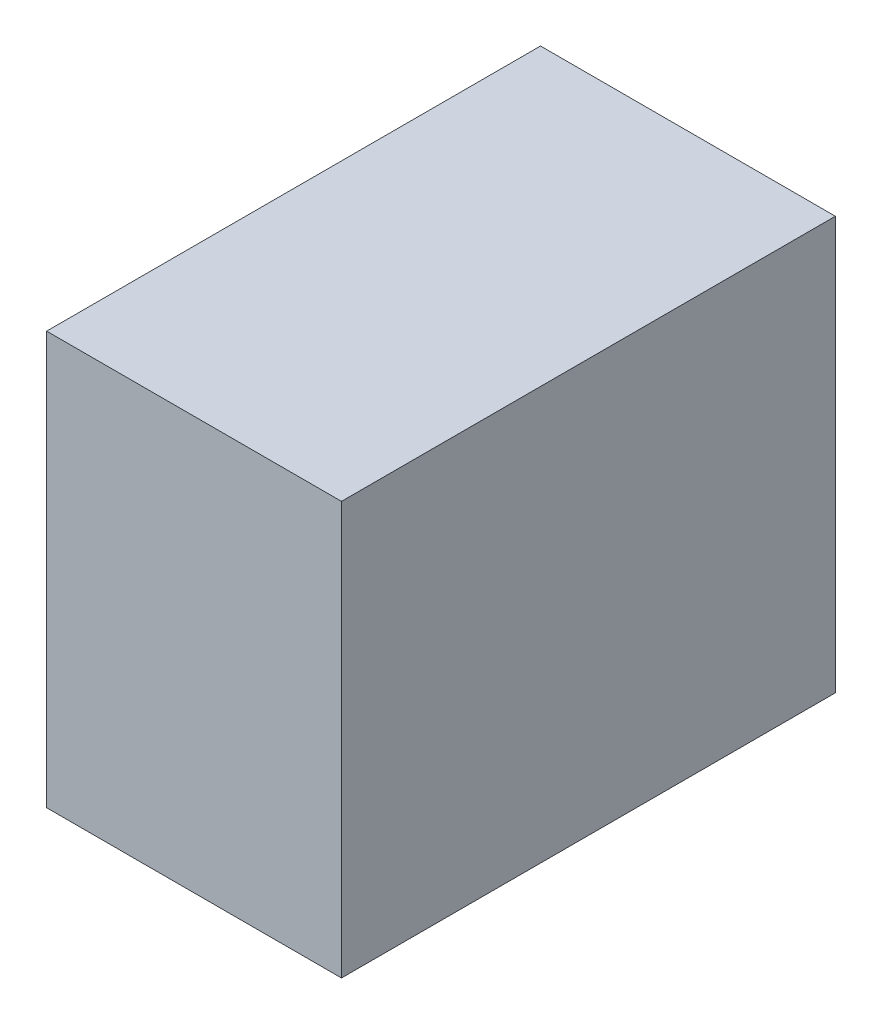
from build123d import *

# Parameters (mm, degrees)
SKETCH_1_W      = 40
SKETCH_1_H      = 56
EXTRUDE_1_DEPTH = 67


with BuildPart() as part:
    # 草图1 → 凸台-拉伸1 (new body)
    with BuildSketch(Plane.XY):
        with Locations((-4.615384615, -5.128205128)):
            Rectangle(SKETCH_1_W, SKETCH_1_H)
    extrude(amount=EXTRUDE_1_DEPTH)


solid = part.part
